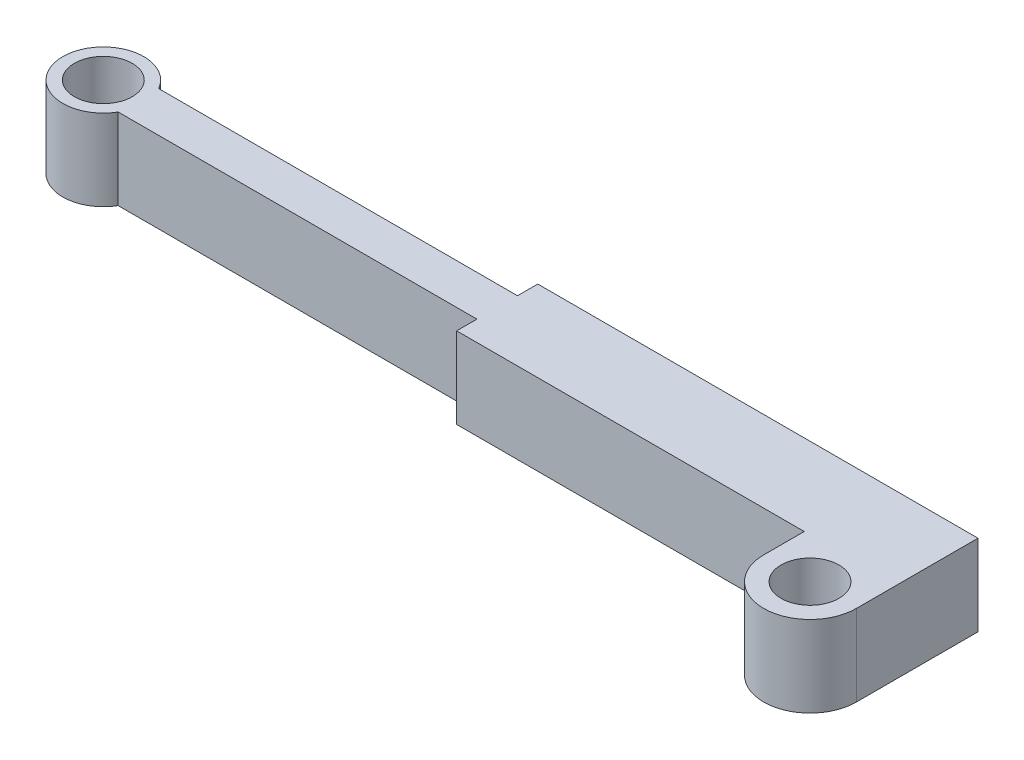
from build123d import *

# Parameters (mm, degrees)
SKETCH1_R           = 2.5
BOSS_EXTRUDE1_DEPTH = 7


with BuildPart() as part:
    # Sketch1 → Boss-Extrude1 (new body)
    with BuildSketch(Plane(origin=(0, 0, 0), x_dir=(1, 0, 0), z_dir=(0, 1, 0))):
        with BuildLine():
            Line((68, 3.5), (38, 3.5))
            Line((38, 3.5), (38, 1.75))
            Line((38, 1.75), (7.031088913, 1.75))
            ThreePointArc((7.031088913, 1.75), (0.5, 0), (7.031088913, -1.75))
            Line((7.031088913, -1.75), (38, -1.75))
            Line((38, -1.75), (38, -3.5))
            Line((38, -3.5), (68, -3.5))
            Line((68, -3.5), (68, -7))
            ThreePointArc((68, -7), (72, -11), (76, -7))
            Line((76, -7), (76, 3.5))
            Line((76, 3.5), (68, 3.5))
        make_face()
        with Locations(Location((72, -7, 0), (0, 0, 270))):
            Circle(SKETCH1_R, mode=Mode.SUBTRACT)
        with Locations(Location((4, 0, 0), (0, 0, 270))):
            Circle(SKETCH1_R, mode=Mode.SUBTRACT)
    extrude(amount=BOSS_EXTRUDE1_DEPTH)


solid = part.part
